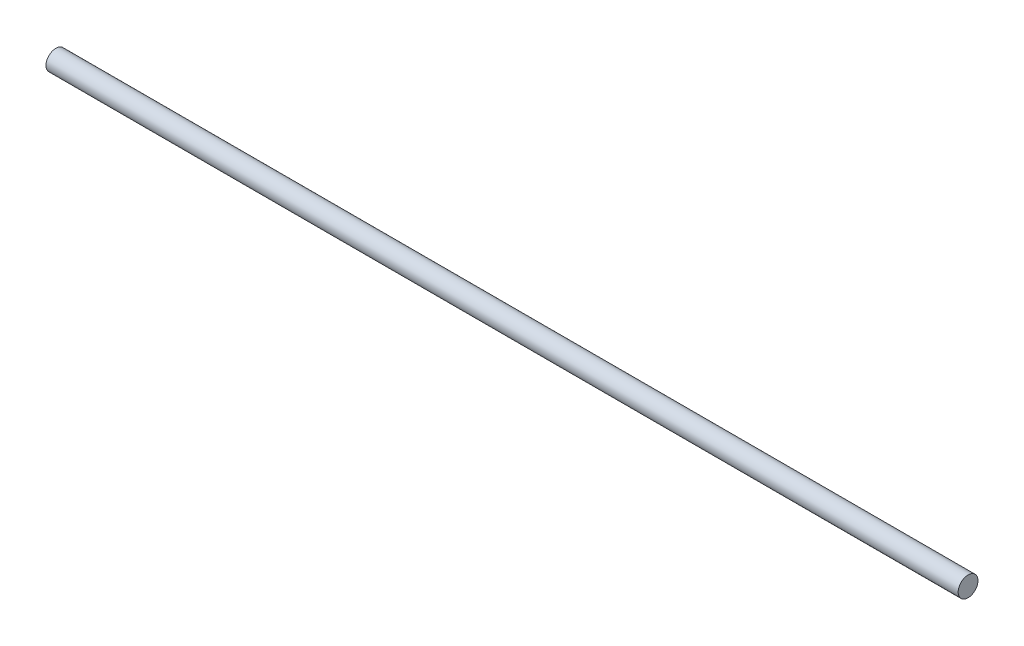
from build123d import *

# Parameters (mm, degrees)
SKETCH1_R           = 1.25
BOSS_EXTRUDE1_DEPTH = 115


with BuildPart() as part:
    # Sketch1 → Boss-Extrude1 (new body)
    with BuildSketch(Plane(origin=(0, 0, 0), x_dir=(0, 0, -1), z_dir=(1, 0, 0))):
        Circle(SKETCH1_R)
    extrude(amount=BOSS_EXTRUDE1_DEPTH)


solid = part.part
